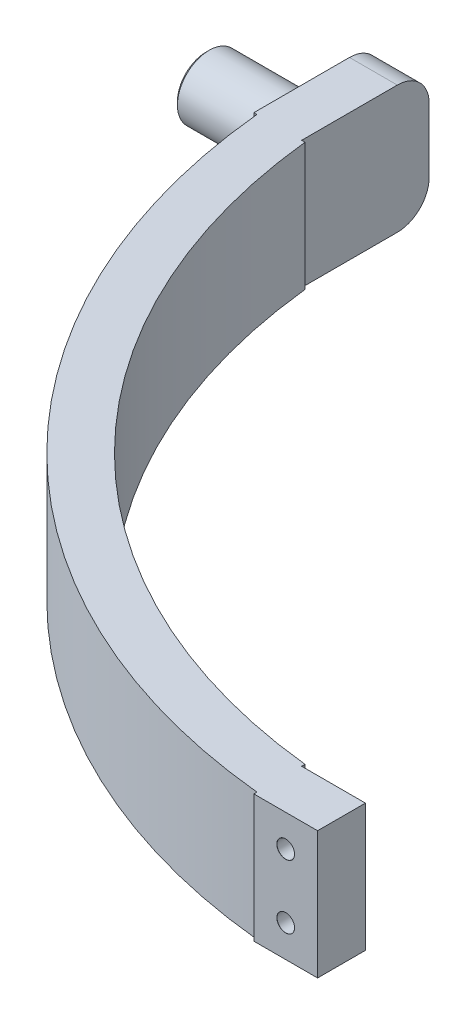
from build123d import *

# Parameters (mm, degrees)
BOSS_EXTRUDE4_DEPTH            = 40
SKETCH18_R                     = 12.5
BOSS_EXTRUDE2_DEPTH            = 5
SKETCH19_R                     = 9.95
BOSS_EXTRUDE3_DEPTH            = 30
FILLET1_R                      = 10
M5_CLEARANCE_HOLE1_D           = 5.5
M5_CLEARANCE_HOLE1_CSINK_D     = 5.55
M5_CLEARANCE_HOLE1_CSINK_ANGLE = 90
CHAMFER1_SIZE                  = 1


with BuildPart() as part:
    # Sketch20 → Boss-Extrude4 (new body)
    with BuildSketch(Plane(origin=(0, 0, 0), x_dir=(1, 0, 0), z_dir=(0, 1, 0))):
        with BuildLine():
            Line((0, 0), (0, -20))
            Line((0, -20), (0, -40))
            Line((0, -40), (0.977942369, -40))
            ThreePointArc((0.977942369, -40), (60.043109857, -164.956890143), (185, -224.022057631))
            Line((185, -224.022057631), (185, -225))
            Line((185, -225), (205, -225))
            Line((205, -225), (205, -210))
            Line((205, -210), (185, -210))
            Line((185, -210), (185, -208.944436277))
            ThreePointArc((185, -208.944436277), (70.649711575, -154.350288425), (16.055563723, -40))
            Line((16.055563723, -40), (15, -40))
            Line((15, -40), (15, -20))
            Line((15, -20), (15, 0))
            Line((15, 0), (0, 0))
        make_face()
    extrude(amount=BOSS_EXTRUDE4_DEPTH)

    # Sketch18 → Boss-Extrude2 (add)
    with BuildSketch(Plane.ZY):
        with Locations((20, 20)):
            Circle(SKETCH18_R)
    extrude(amount=BOSS_EXTRUDE2_DEPTH)

    # Sketch19 → Boss-Extrude3 (add)
    with BuildSketch(Plane.ZY.offset(5)):
        with Locations((20, 20)):
            Circle(SKETCH19_R)
    extrude(amount=BOSS_EXTRUDE3_DEPTH)

    # Fillet1
    fillet1_edges = [part.edges().sort_by_distance(p)[0] for p in [
        (7.5, 0, 0),
        (7.5, 40, 0),
    ]]
    fillet(fillet1_edges, radius=FILLET1_R)

    # M5 Clearance Hole1 (through all)
    with Locations(Plane.XY.offset(225)):
        with Locations((195, 30), (195, 10)):
            CounterSinkHole(M5_CLEARANCE_HOLE1_D / 2, M5_CLEARANCE_HOLE1_CSINK_D / 2, counter_sink_angle=M5_CLEARANCE_HOLE1_CSINK_ANGLE)

    # Chamfer1
    chamfer1_edges = [part.edges().sort_by_distance(p)[0] for p in [
        (-35, 20, 10.05),
    ]]
    chamfer(chamfer1_edges, length=CHAMFER1_SIZE)


solid = part.part
